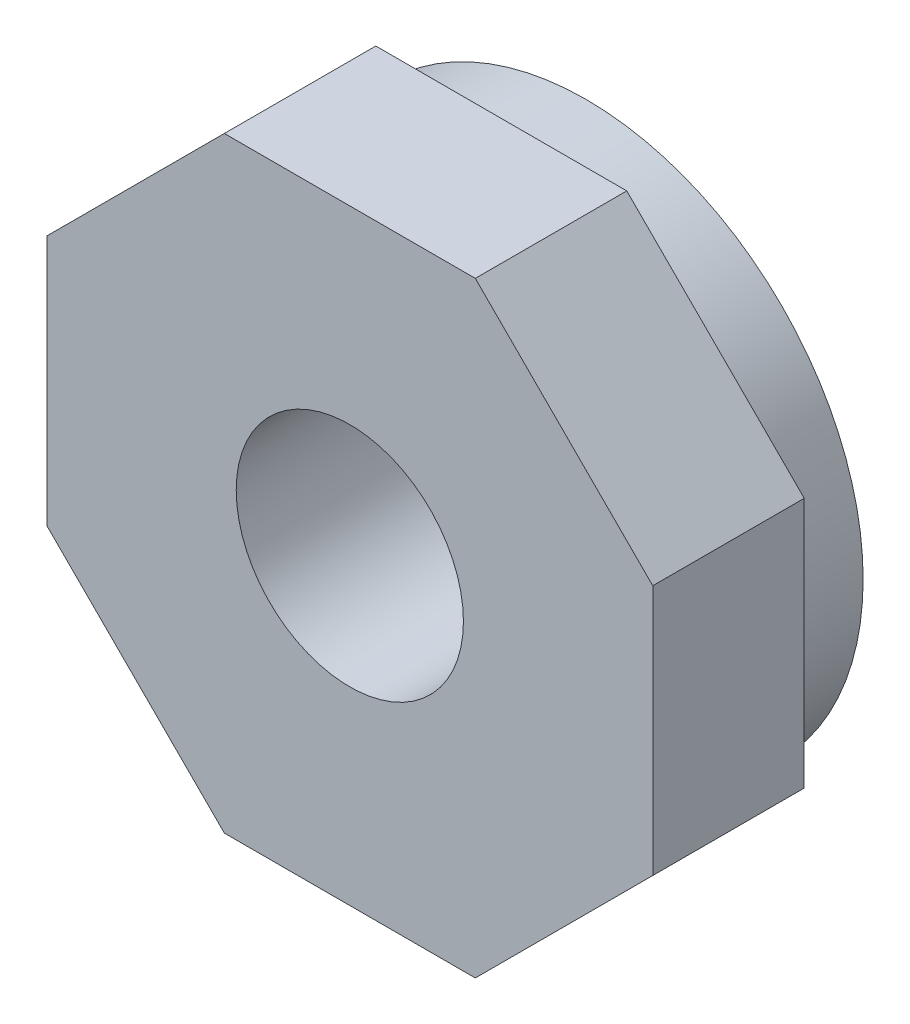
from build123d import *
from build123d.topology import SkipClean

# Parameters (mm, degrees)
SKETCH1_R           = 3.175
SKETCH1_R_2         = 1.190625
BOSS_EXTRUDE1_DEPTH = 1.5875
BOSS_EXTRUDE2_START = 0.889
SKETCH2_R           = 2.903167089
SKETCH2_R_2         = 1.190625
BOSS_EXTRUDE2_DEPTH = 0.889


with BuildPart() as part:
    # Sketch1 → Boss-Extrude1 (new body)
    # profile 1 of 9: a face of its own
    with BuildSketch(Plane.XY):
        Circle(SKETCH1_R)
        Circle(SKETCH1_R_2, mode=Mode.SUBTRACT)
    # profile 2 of 9: a face of its own
    with BuildSketch(Plane.XY):
        with BuildLine():
            Line((0, 3.175), (-1.315128061, 3.175))
            Line((-1.315128061, 3.175), (-2.245064028, 2.245064033))
            ThreePointArc((-2.245064028, 2.245064033), (-1.215019896, 2.933317516), (0, 3.175))
        make_face()
    # profile 3 of 9: a face of its own
    with BuildSketch(Plane.XY):
        with BuildLine():
            Line((1.315128061, 3.175), (0, 3.175))
            ThreePointArc((0, 3.175), (1.215019907, 2.933317512), (2.245064044, 2.245064016))
            Line((2.245064044, 2.245064016), (1.315128061, 3.175))
        make_face()
    # profile 4 of 9: a face of its own
    with BuildSketch(Plane.XY):
        with BuildLine():
            Line((3.175, 1.315128061), (2.245064044, 2.245064016))
            ThreePointArc((2.245064044, 2.245064016), (2.933317519, 1.215019889), (3.175, 0))
            Line((3.175, 0), (3.175, 1.315128061))
        make_face()
    # profile 5 of 9: a face of its own
    with BuildSketch(Plane.XY):
        with BuildLine():
            Line((3.175, -1.315128061), (3.175, 0))
            ThreePointArc((3.175, 0), (2.933317516, -1.215019896), (2.245064033, -2.245064028))
            Line((2.245064033, -2.245064028), (3.175, -1.315128061))
        make_face()
    # profile 6 of 9: a face of its own
    with BuildSketch(Plane.XY):
        with BuildLine():
            Line((1.315128061, -3.175), (2.245064033, -2.245064028))
            ThreePointArc((2.245064033, -2.245064028), (1.215019894, -2.933317517), (-1.2e-08, -3.175))
            Line((-1.2e-08, -3.175), (1.315128061, -3.175))
        make_face()
    # profile 7 of 9: a face of its own
    with BuildSketch(Plane.XY):
        with BuildLine():
            ThreePointArc((-1.2e-08, -3.175), (-1.215019897, -2.933317516), (-2.245064021, -2.245064039))
            Line((-2.245064021, -2.245064039), (-1.315128061, -3.175))
            Line((-1.315128061, -3.175), (-1.2e-08, -3.175))
        make_face()
    # profile 8 of 9: a face of its own
    with BuildSketch(Plane.XY):
        with BuildLine():
            ThreePointArc((-2.245064021, -2.245064039), (-2.933317513, -1.215019904), (-3.175, 0))
            Line((-3.175, 0), (-3.175, -1.315128061))
            Line((-3.175, -1.315128061), (-2.245064021, -2.245064039))
        make_face()
    # profile 9 of 9: a face of its own
    with BuildSketch(Plane.XY):
        with BuildLine():
            ThreePointArc((-3.175, 0), (-2.933317515, 1.215019899), (-2.245064028, 2.245064033))
            Line((-2.245064028, 2.245064033), (-3.175, 1.315128061))
            Line((-3.175, 1.315128061), (-3.175, 0))
        make_face()
    extrude(amount=BOSS_EXTRUDE1_DEPTH)

    # Sketch2 → Boss-Extrude2 (add)
    with SkipClean():  # the faces are left unmerged after this step: merging them gives an invalid solid
        with BuildSketch(Plane(origin=(0, 0, 0), x_dir=(-1, 0, 0), z_dir=(0, 0, -1)).offset(BOSS_EXTRUDE2_START)):
            with Locations(Location((0, 0, 0), (0, 0, 180))):
                Circle(SKETCH2_R)
            Circle(SKETCH2_R_2, mode=Mode.SUBTRACT)
        extrude(amount=-BOSS_EXTRUDE2_DEPTH)


solid = part.part
